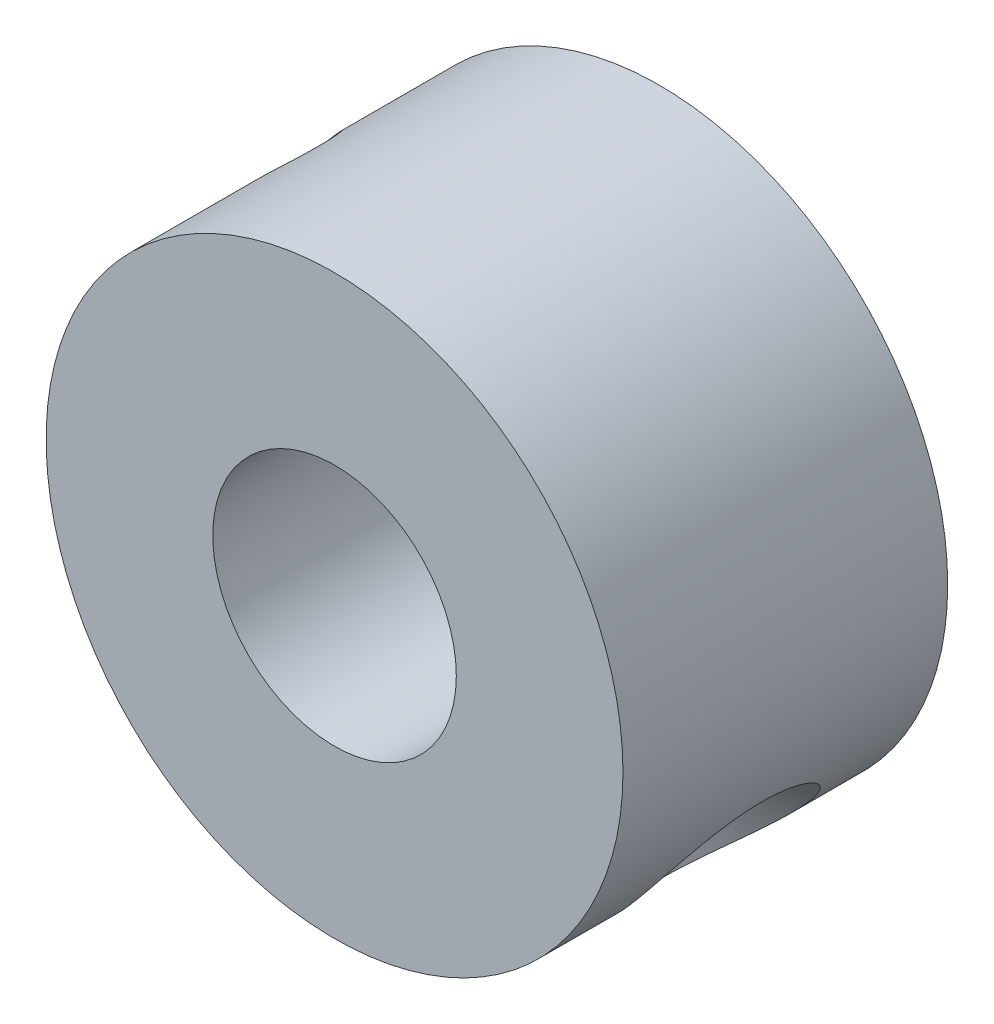
from build123d import *

# Parameters (mm, degrees)
SKETCH1_R                                       = 7.105443578
SKETCH1_R_2                                     = 3
BOSS_EXTRUDE3_DEPTH                             = 8
CSK_FOR_M2_FLAT_HEAD_MACHINE_SCREW2_D           = 2.4
CSK_FOR_M2_FLAT_HEAD_MACHINE_SCREW2_CSINK_D     = 4.4
CSK_FOR_M2_FLAT_HEAD_MACHINE_SCREW2_CSINK_ANGLE = 90


with BuildPart() as part:
    # Sketch1 → Boss-Extrude3 (new body)
    with BuildSketch(Plane.XY):
        Circle(SKETCH1_R)
        Circle(SKETCH1_R_2, mode=Mode.SUBTRACT)
    extrude(amount=BOSS_EXTRUDE3_DEPTH)

    # CSK for M2 Flat Head Machine Screw2 (through all)
    with Locations(Plane(origin=(5.371974404, -4.650722466, 3.893731666), x_dir=(0.654529504622, 0.75603645916, 0), z_dir=(0.75603645916, -0.654529504622, 0))):
        with Locations((0, 0)):
            CounterSinkHole(CSK_FOR_M2_FLAT_HEAD_MACHINE_SCREW2_D / 2, CSK_FOR_M2_FLAT_HEAD_MACHINE_SCREW2_CSINK_D / 2, counter_sink_angle=CSK_FOR_M2_FLAT_HEAD_MACHINE_SCREW2_CSINK_ANGLE)


solid = part.part
